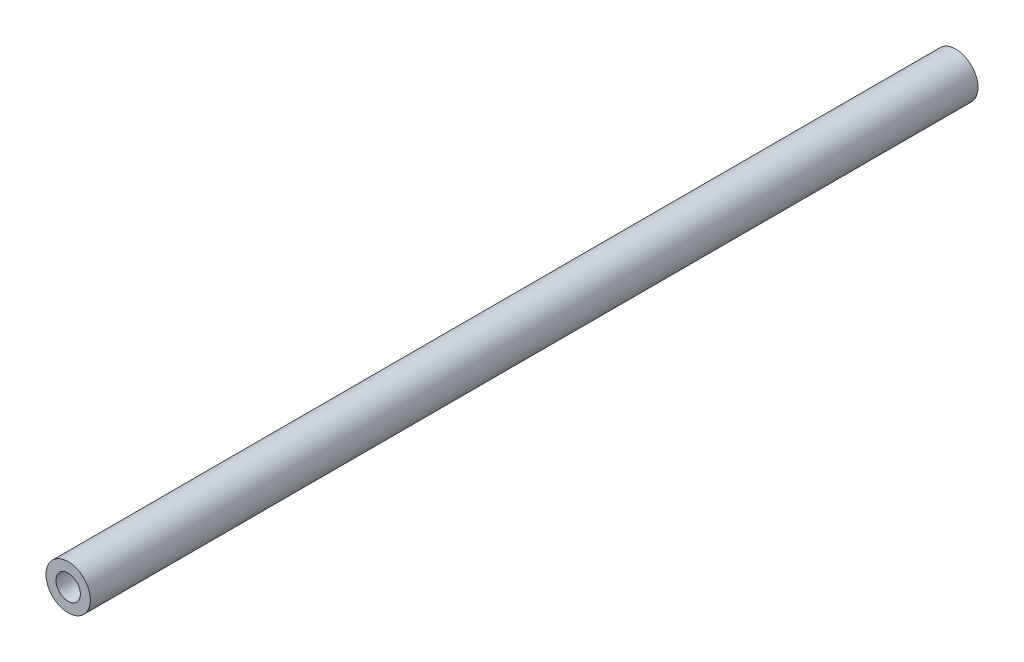
from build123d import *

# Parameters (mm, degrees)
SKETCH1_R           = 3
BOSS_EXTRUDE1_DEPTH = 120


with BuildPart() as part:
    # Sketch1 → Boss-Extrude1 (new body)
    with BuildSketch(Plane.XY):
        Circle(SKETCH1_R)
    extrude(amount=BOSS_EXTRUDE1_DEPTH)

    # Sketch3 → M4x0.7 Tapped Hole1 (revolve, cut)
    with BuildSketch(Plane(origin=(0, 0, 120), x_dir=(0, -1, 0), z_dir=(1, 0, 0))):
        Polygon((0, 0), (0, 10.991420021), (1.65, 10), (1.65, 0), align=None)
    m4x0_7_tapped_hole1 = revolve(axis=Axis((0, 0, 126.35), (0, 0, -1)), mode=Mode.SUBTRACT)

    # Mirror1: M4x0.7 Tapped Hole1 across plane
    add(m4x0_7_tapped_hole1.mirror(Plane.XY.offset(60)), mode=Mode.SUBTRACT)


solid = part.part
